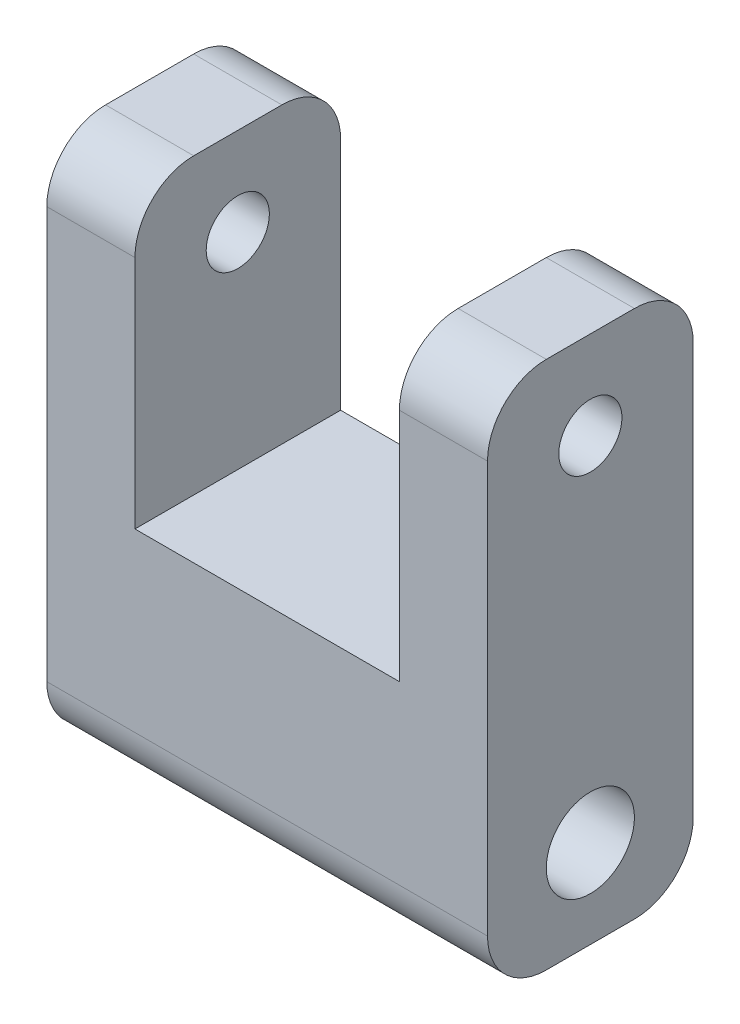
from build123d import *

# Parameters (mm, degrees)
SKETCH_1_W          = 20
SKETCH_1_H          = 18
EXTRUDE_1_DEPTH     = 15
SKETCH_2_R          = 1.5
CUT_EXTRUDE_1_DEPTH = 31.805843601
SKETCH_3_W          = 10
SKETCH_3_H          = 10
CUT_EXTRUDE_2_DEPTH = 15
SKETCH_5_W          = 4
SKETCH_5_H          = 18
CUT_EXTRUDE_3_DEPTH = 31.805843601
SKETCH_6_R          = 1
CUT_EXTRUDE_4_DEPTH = 30.068883707
SKETCH_8_W          = 11.4
SKETCH_8_H          = 10
CUT_EXTRUDE_5_DEPTH = 10
SKETCH_9_W          = 11.4
SKETCH_9_H          = 10
EXTRUDE_2_DEPTH     = 7
SKETCH_10_R         = 1.075
CUT_EXTRUDE_6_DEPTH = 20
SKETCH_11_W         = 5
SKETCH_11_H         = 18
CUT_EXTRUDE_7_DEPTH = 20
SKETCH_12_W         = 9
SKETCH_12_H         = 10
CUT_EXTRUDE_8_DEPTH = 20
FILLET_1_R          = 2
FILLET_2_R          = 2
FILLET_3_R          = 2
FILLET_4_R          = 2
FILLET_5_R          = 2
FILLET_6_R          = 2


with BuildPart() as part:
    # 草图1 → 凸台-拉伸1 (new body)
    with BuildSketch(Plane.XY):
        with Locations((10, 9)):
            Rectangle(SKETCH_1_W, SKETCH_1_H)
    extrude(amount=EXTRUDE_1_DEPTH)

    # 草图2 → 切除-拉伸1 (cut, through all)
    with BuildSketch(Plane(origin=(20, 0, 0), x_dir=(0, 0, -1), z_dir=(1, 0, 0))):
        with Locations(Location((-7.5, 3, 0), (0, 0, 90))):
            Circle(SKETCH_2_R)
        with Locations((-7.5, 22)):
            Circle(SKETCH_2_R)
    extrude(amount=-CUT_EXTRUDE_1_DEPTH, mode=Mode.SUBTRACT)

    # 草图3 → 切除-拉伸2 (cut)
    with BuildSketch(Plane.XY.offset(15)):
        with Locations((10, 13)):
            Rectangle(SKETCH_3_W, SKETCH_3_H)
    extrude(amount=-CUT_EXTRUDE_2_DEPTH, mode=Mode.SUBTRACT)

    # 草图5 → 切除-拉伸3 (cut, through all)
    with BuildSketch(Plane(origin=(20, 0, 0), x_dir=(0, 0, -1), z_dir=(1, 0, 0))):
        with Locations((-13, 9)):
            Rectangle(SKETCH_5_W, SKETCH_5_H)
        with Locations((-2, 9)):
            Rectangle(SKETCH_5_W, SKETCH_5_H)
    extrude(amount=-CUT_EXTRUDE_3_DEPTH, mode=Mode.SUBTRACT)

    # 草图6 → 切除-拉伸4 (cut, through all)
    with BuildSketch(Plane(origin=(20, 0, 0), x_dir=(0, 0, -1), z_dir=(1, 0, 0))):
        with Locations(Location((-7.5, 15, 0), (0, 0, 90))):
            Circle(SKETCH_6_R)
    extrude(amount=-CUT_EXTRUDE_4_DEPTH, mode=Mode.SUBTRACT)

    # 草图8 → 切除-拉伸5 (cut)
    with BuildSketch(Plane.XY.offset(11)):
        with Locations((10, 13)):
            Rectangle(SKETCH_8_W, SKETCH_8_H)
    extrude(amount=-CUT_EXTRUDE_5_DEPTH, mode=Mode.SUBTRACT)

    # 草图9 → 凸台-拉伸2 (add)
    with BuildSketch(Plane.XY.offset(11)):
        with Locations((10, 13)):
            Rectangle(SKETCH_9_W, SKETCH_9_H)
    extrude(amount=-EXTRUDE_2_DEPTH)

    # 草图10 → 切除-拉伸6 (cut)
    with BuildSketch(Plane(origin=(20, 0, 0), x_dir=(0, 0, -1), z_dir=(1, 0, 0))):
        with Locations(Location((-7.5, 15, 0), (0, 0, 90))):
            Circle(SKETCH_10_R)
    extrude(amount=-CUT_EXTRUDE_6_DEPTH, mode=Mode.SUBTRACT)

    # 草图11 → 切除-拉伸7 (cut)
    with BuildSketch(Plane.XY.offset(11)):
        with Locations((17.5, 9)):
            Rectangle(SKETCH_11_W, SKETCH_11_H)
    extrude(amount=-CUT_EXTRUDE_7_DEPTH, mode=Mode.SUBTRACT)

    # 草图12 → 切除-拉伸8 (cut)
    with BuildSketch(Plane.XY.offset(11)):
        with Locations((7.5, 13)):
            Rectangle(SKETCH_12_W, SKETCH_12_H)
    extrude(amount=-CUT_EXTRUDE_8_DEPTH, mode=Mode.SUBTRACT)

    # 圆角1
    fillet_1_edges = [part.edges().sort_by_distance(p)[0] for p in [
        (7.5, 0, 11),
    ]]
    fillet(fillet_1_edges, radius=FILLET_1_R)

    # 圆角2
    fillet_2_edges = [part.edges().sort_by_distance(p)[0] for p in [
        (7.5, 0, 4),
    ]]
    fillet(fillet_2_edges, radius=FILLET_2_R)

    # 圆角3
    fillet_3_edges = [part.edges().sort_by_distance(p)[0] for p in [
        (1.5, 18, 11),
    ]]
    fillet(fillet_3_edges, radius=FILLET_3_R)

    # 圆角4
    fillet_4_edges = [part.edges().sort_by_distance(p)[0] for p in [
        (13.5, 18, 11),
    ]]
    fillet(fillet_4_edges, radius=FILLET_4_R)

    # 圆角5
    fillet_5_edges = [part.edges().sort_by_distance(p)[0] for p in [
        (13.5, 18, 4),
    ]]
    fillet(fillet_5_edges, radius=FILLET_5_R)

    # 圆角6
    fillet_6_edges = [part.edges().sort_by_distance(p)[0] for p in [
        (1.5, 18, 4),
    ]]
    fillet(fillet_6_edges, radius=FILLET_6_R)


solid = part.part
